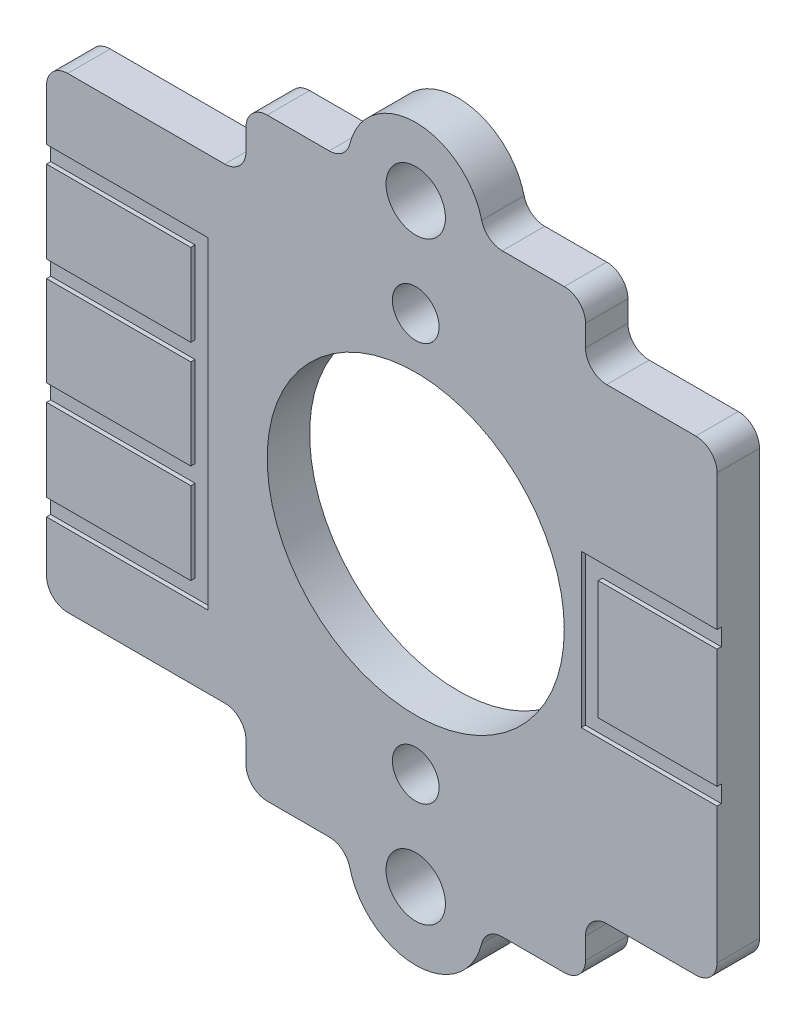
from build123d import *

# Parameters (mm, degrees)
MODEL_R         = 3.5
MODEL_R_2       = 0.7
EXTRUDE_1_DEPTH = 0.5
EXTRUDE2_DEPTH  = 0.1
SKETCH3_R       = 0.55
EXTRUDE3_DEPTH  = 13.273956167


with BuildPart() as part:
    # Model → Бобышка-Вытянуть1 (new, symmetric)
    with BuildSketch(Plane.XY):
        with BuildLine():
            Line((-3.5, 7), (-2.039607805, 7))
            ThreePointArc((-2.039607805, 7), (-1.731001106, 7.106602104), (-1.553986899, 7.380952381))
            ThreePointArc((-1.553986899, 7.380952381), (0, 8.6), (1.553986899, 7.380952381))
            ThreePointArc((1.553986899, 7.380952381), (1.731001106, 7.106602104), (2.039607805, 7))
            Line((2.039607805, 7), (3.5, 7))
            ThreePointArc((3.5, 7), (3.853553391, 6.853553391), (4, 6.5))
            Line((4, 6.5), (4, 6))
            ThreePointArc((4, 6), (4.146446609, 5.646446609), (4.5, 5.5))
            Line((4.5, 5.5), (6.6, 5.5))
            ThreePointArc((6.6, 5.5), (6.953553391, 5.353553391), (7.1, 5))
            Line((7.1, 5), (7.1, -5))
            ThreePointArc((7.1, -5), (6.953553391, -5.353553391), (6.6, -5.5))
            Line((6.6, -5.5), (4.5, -5.5))
            ThreePointArc((4.5, -5.5), (4.146446609, -5.646446609), (4, -6))
            Line((4, -6), (4, -6.5))
            ThreePointArc((4, -6.5), (3.853553391, -6.853553391), (3.5, -7))
            Line((3.5, -7), (2.039607805, -7))
            ThreePointArc((2.039607805, -7), (1.731001106, -7.106602104), (1.553986899, -7.380952381))
            ThreePointArc((1.553986899, -7.380952381), (0, -8.6), (-1.553986899, -7.380952381))
            ThreePointArc((-1.553986899, -7.380952381), (-1.731001106, -7.106602104), (-2.039607805, -7))
            Line((-2.039607805, -7), (-3.5, -7))
            ThreePointArc((-3.5, -7), (-3.853553391, -6.853553391), (-4, -6.5))
            Line((-4, -6.5), (-4, -6))
            ThreePointArc((-4, -6), (-4.146446609, -5.646446609), (-4.5, -5.5))
            Line((-4.5, -5.5), (-8.2, -5.5))
            ThreePointArc((-8.2, -5.5), (-8.553553391, -5.353553391), (-8.7, -5))
            Line((-8.7, -5), (-8.7, 5))
            ThreePointArc((-8.7, 5), (-8.553553391, 5.353553391), (-8.2, 5.5))
            Line((-8.2, 5.5), (-4.5, 5.5))
            ThreePointArc((-4.5, 5.5), (-4.146446609, 5.646446609), (-4, 6))
            Line((-4, 6), (-4, 6.5))
            ThreePointArc((-4, 6.5), (-3.853553391, 6.853553391), (-3.5, 7))
        make_face()
        Circle(MODEL_R, mode=Mode.SUBTRACT)
        with Locations((0, 7)):
            Circle(MODEL_R_2, mode=Mode.SUBTRACT)
        with Locations((0, -7)):
            Circle(MODEL_R_2, mode=Mode.SUBTRACT)
    extrude(amount=EXTRUDE_1_DEPTH, both=True)

    # Sketch2 → Extrude2 (cut)
    with BuildSketch(Plane.XY.offset(0.5)):
        Polygon((-9.557418436, -3.8), (-4.9, -3.8), (-4.9, 3.8), (-9.557418436, 3.8), (-9.557418436, 3.4), (-5.3, 3.4), (-5.3, 1.462476295), (-9.557418436, 1.462476295), (-9.557418436, 1.062476295), (-5.3, 1.062476295), (-5.3, -1.062476295), (-9.557418436, -1.062476295), (-9.557418436, -1.462476295), (-5.3, -1.462476295), (-5.3, -3.4), (-9.557418436, -3.4), align=None)
        Polygon((7.739654587, -1.8), (7.739654587, -1.4), (4.3, -1.4), (4.3, 1.4), (7.739654587, 1.4), (7.739654587, 1.8), (3.9, 1.8), (3.9, -1.8), align=None)
    extrude(amount=-EXTRUDE2_DEPTH, mode=Mode.SUBTRACT)

    # Sketch3 → Extrude3 (cut, through all)
    with BuildSketch(Plane.XY.offset(0.5)):
        with Locations((0, 4.7)):
            Circle(SKETCH3_R)
        with Locations((0, -4.7)):
            Circle(SKETCH3_R)
    extrude(amount=-EXTRUDE3_DEPTH, mode=Mode.SUBTRACT)


solid = part.part
